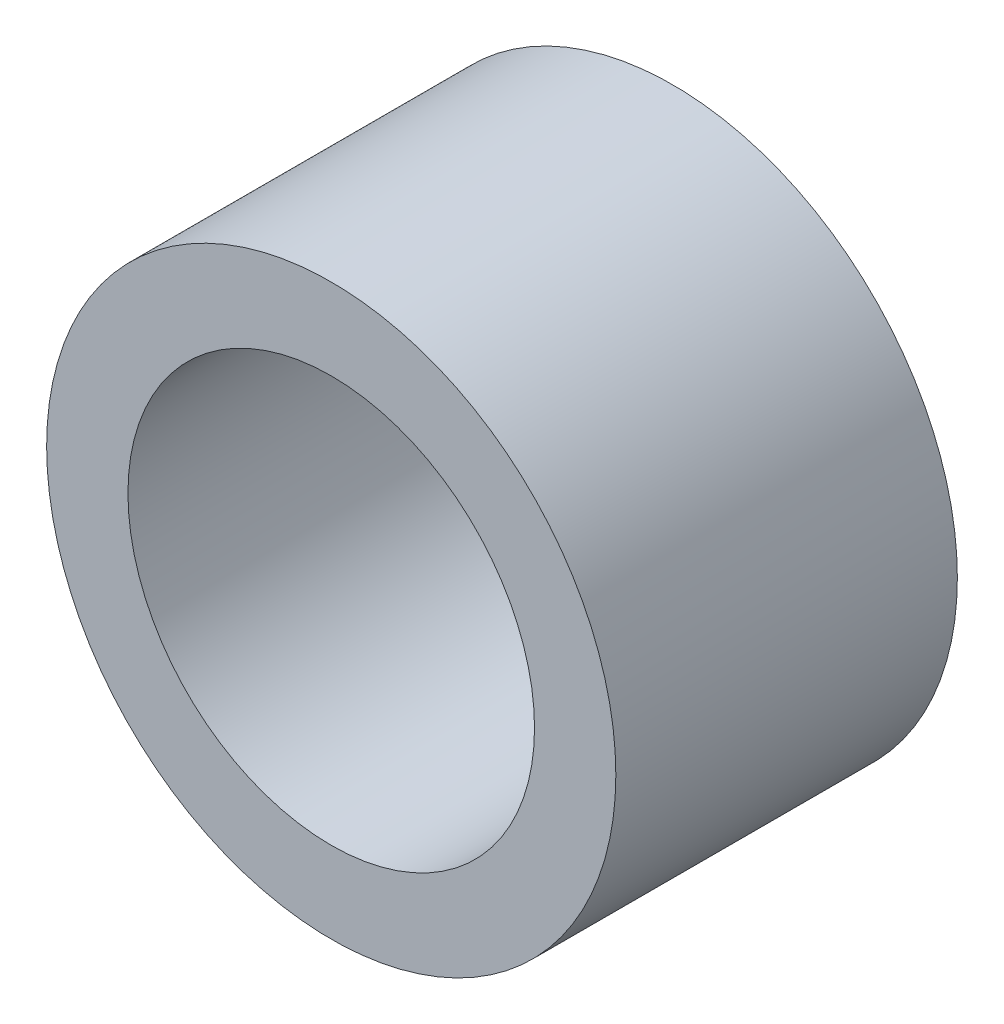
from build123d import *

# Parameters (mm, degrees)
SKETCH2_R           = 17.5
SKETCH2_R_2         = 12.5
BOSS_EXTRUDE1_DEPTH = 21


with BuildPart() as part:
    # Sketch2 → Boss-Extrude1 (new body)
    with BuildSketch(Plane.XY):
        with Locations(Location((0, 0, 0), (0, 0, 180))):
            Circle(SKETCH2_R)
        with Locations(Location((0, 0, 0), (0, 0, 180))):
            Circle(SKETCH2_R_2, mode=Mode.SUBTRACT)
    extrude(amount=BOSS_EXTRUDE1_DEPTH)


solid = part.part
